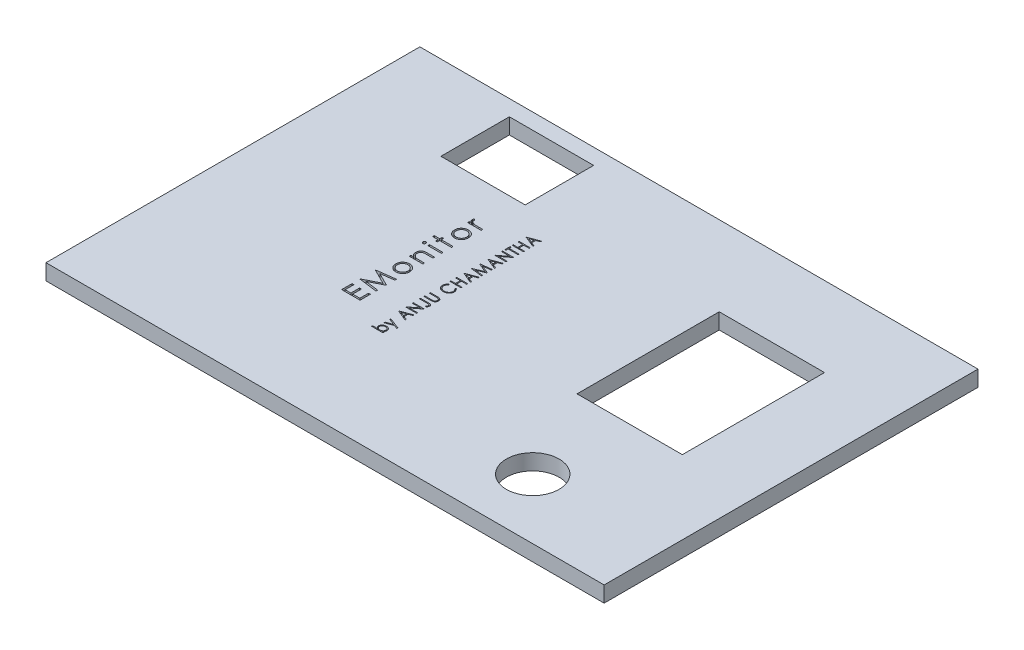
from build123d import *

# Parameters (mm, degrees)
SKETCH1_W           = 106
SKETCH1_H           = 71
SKETCH1_R           = 5
SKETCH1_W_2         = 20
SKETCH1_H_2         = 27
BOSS_EXTRUDE3_DEPTH = 3
SKETCH2_W           = 16
SKETCH2_H           = 13
CUT_EXTRUDE1_DEPTH  = 103.258706534
SKETCH3_W           = 2.557692308
SKETCH3_H           = 0.314102564
CUT_EXTRUDE2_DEPTH  = 1


with BuildPart() as part:
    # Sketch1 → Boss-Extrude3 (new body)
    with BuildSketch(Plane(origin=(0, 0, 0), x_dir=(1, 0, 0), z_dir=(0, 1, 0))):
        with Locations((-42.793088024, 0.158482143)):
            Rectangle(SKETCH1_W, SKETCH1_H)
        with Locations(Location((-14.793088024, -23.904605951, 0), (0, 0, 270))):
            Circle(SKETCH1_R, mode=Mode.SUBTRACT)
        with Locations((-13.793088024, 7.010525239)):
            Rectangle(SKETCH1_W_2, SKETCH1_H_2, mode=Mode.SUBTRACT)
    extrude(amount=BOSS_EXTRUDE3_DEPTH)

    # Sketch2 → Cut-Extrude1 (cut, through all)
    with BuildSketch(Plane(origin=(0, 3, 0), x_dir=(1, 0, 0), z_dir=(0, 1, 0))):
        with Locations((-67.793088024, 26.158482143)):
            Rectangle(SKETCH2_W, SKETCH2_H)
    extrude(amount=-CUT_EXTRUDE1_DEPTH, mode=Mode.SUBTRACT)

    # Sketch3 → Cut-Extrude2 (cut)
    # profile 1 of 24: a face of its own
    with BuildSketch(Plane(origin=(0, 3, 0), x_dir=(1, 0, 0), z_dir=(0, 1, 0))):
        Polygon((-63.293088024, -11.696646062), (-63.293088024, -9.722287088), (-62.934113665, -9.722287088), (-62.934113665, -11.382543498), (-61.857190588, -11.382543498), (-61.857190588, -9.722287088), (-61.498216229, -9.722287088), (-61.498216229, -11.382543498), (-60.152062383, -11.382543498), (-60.152062383, -9.722287088), (-59.793088024, -9.722287088), (-59.793088024, -11.696646062), align=None)
    # profile 2 of 24: a face of its own
    with BuildSketch(Plane(origin=(0, 3, 0), x_dir=(1, 0, 0), z_dir=(0, 1, 0))):
        Polygon((-59.793088024, -8.681261447), (-63.293088024, -8.219222184), (-63.293088024, -8.174350389), (-60.421293153, -6.72933837), (-63.293088024, -5.28783196), (-63.293088024, -5.242259043), (-59.793088024, -4.777415293), (-59.793088024, -5.092920101), (-62.311517511, -5.428056319), (-59.793088024, -6.691477793), (-59.793088024, -6.762291094), (-62.317126486, -8.030620421), (-59.793088024, -8.365055517), align=None)
    # profile 3 of 24: a face of its own
    with BuildSketch(Plane(origin=(0, 3, 0), x_dir=(1, 0, 0), z_dir=(0, 1, 0))):
        with BuildLine():
            add(Edge.make_bspline(
                [(-62.395652127, -2.32152587), (-62.394630236, -2.273534597), (-62.392626557, -2.17943544), (-62.371211591, -2.041627554), (-62.338464227, -1.910082418), (-62.293192665, -1.784296226), (-62.232510714, -1.66587993), (-62.160101423, -1.553108686), (-62.07431883, -1.446291677), (-62.007960761, -1.382268648), (-61.974277928, -1.349771062)],
                knots=[0, 0, 0, 0, 1.054011418, 2.066658804, 3.057071809, 4.030435133, 4.997543892, 5.974964718, 6.972108034, 8, 8, 8, 8], degree=3))
            add(Edge.make_bspline(
                [(-61.974277928, -1.349771062), (-61.942063942, -1.321789108), (-61.8782594, -1.266366728), (-61.774803787, -1.195301009), (-61.667663687, -1.134079449), (-61.55541636, -1.085016488), (-61.439041689, -1.046331464), (-61.318139678, -1.018865768), (-61.19297733, -1.002528833), (-61.107973492, -1.000325866), (-61.06492296, -0.999210165)],
                knots=[0, 0, 0, 0, 1.025258237, 2.030674902, 3.01204498, 3.988269485, 4.97094183, 5.956517959, 6.965070386, 8, 8, 8, 8], degree=3))
            add(Edge.make_bspline(
                [(-61.06492296, -0.999210165), (-61.021622903, -1.000191502), (-60.936059969, -1.00213067), (-60.810040603, -1.020474287), (-60.687845781, -1.049005373), (-60.569987087, -1.089837211), (-60.45610426, -1.14219532), (-60.34669471, -1.206086008), (-60.241542577, -1.281957625), (-60.141540739, -1.367961622), (-60.049374524, -1.463013498), (-59.969046254, -1.566129646), (-59.90022473, -1.67528368), (-59.844788314, -1.791927033), (-59.801078614, -1.91499452), (-59.770378598, -2.044751588), (-59.751816914, -2.180996658), (-59.749433341, -2.27402388), (-59.748216229, -2.32152587)],
                knots=[0, 0, 0, 0, 0.998656419, 1.973391657, 2.932242238, 3.890759089, 4.846373663, 5.82037756, 6.809684879, 7.83454468, 8.860553229, 9.859544525, 10.845671541, 11.83227036, 12.833544569, 13.85385346, 14.904124723, 16, 16, 16, 16], degree=3))
            add(Edge.make_bspline(
                [(-59.748216229, -2.32152587), (-59.749437426, -2.369260589), (-59.7518292, -2.462751449), (-59.770306483, -2.599477431), (-59.801064465, -2.72946705), (-59.844931958, -2.852695649), (-59.900226502, -2.969840496), (-59.968838192, -3.079626992), (-60.049398347, -3.182826908), (-60.141534284, -3.277898892), (-60.24154424, -3.363897498), (-60.346694279, -3.439770506), (-60.456104372, -3.503660832), (-60.569987057, -3.556019036), (-60.687845789, -3.596850849), (-60.810040601, -3.625381942), (-60.93605997, -3.643725556), (-61.021622903, -3.645664725), (-61.06492296, -3.646646062)],
                knots=[0, 0, 0, 0, 1.099876186, 2.154163076, 3.173186993, 4.173200201, 5.163417411, 6.152872554, 7.150605724, 8.17532212, 9.198891216, 10.186952605, 11.159729845, 12.11414092, 13.071450619, 14.029093627, 15.002601286, 16, 16, 16, 16], degree=3))
            add(Edge.make_bspline(
                [(-61.06492296, -3.646646062), (-61.107740461, -3.645525421), (-61.192511755, -3.643306743), (-61.317424955, -3.626947513), (-61.437956936, -3.599780665), (-61.553696108, -3.560559356), (-61.66567365, -3.511587471), (-61.773206585, -3.450982079), (-61.87621014, -3.379228919), (-61.93993007, -3.324021853), (-61.972174563, -3.296085165)],
                knots=[0, 0, 0, 0, 1.031377469, 2.041950136, 3.029500481, 4.003457997, 4.981637986, 5.969878303, 6.97268806, 8, 8, 8, 8], degree=3))
            add(Edge.make_bspline(
                [(-61.972174563, -3.296085165), (-62.006149502, -3.263636574), (-62.072967198, -3.19982071), (-62.158499722, -3.092471982), (-62.232415796, -2.979978161), (-62.291892012, -2.860253235), (-62.338730529, -2.734570377), (-62.371296044, -2.602351134), (-62.392549399, -2.464075619), (-62.394607577, -2.369515998), (-62.395652127, -2.32152587)],
                knots=[0, 0, 0, 0, 1.027980169, 2.021703884, 2.998553061, 3.971491411, 4.943284454, 5.930300938, 6.949603206, 8, 8, 8, 8], degree=3))
        make_face()
        with BuildLine():
            add(Edge.make_bspline(
                [(-62.081549563, -2.322928114), (-62.080584971, -2.356865725), (-62.078680689, -2.423864854), (-62.064196783, -2.522484437), (-62.041249281, -2.617424595), (-62.008645219, -2.708865425), (-61.966546344, -2.796498651), (-61.914837892, -2.880407852), (-61.854205287, -2.960841067), (-61.784741255, -3.036220129), (-61.708867311, -3.105413582), (-61.628000708, -3.165851319), (-61.543380156, -3.217532093), (-61.454878314, -3.259803899), (-61.362193426, -3.292223372), (-61.265871314, -3.315196426), (-61.16562112, -3.329706852), (-61.097458009, -3.331587706), (-61.062819595, -3.332543498)],
                knots=[0, 0, 0, 0, 1.02155314, 2.01673505, 2.994700672, 3.958461264, 4.934171024, 5.916582427, 6.921469794, 7.962398674, 8.998583302, 10.009097305, 10.997513862, 11.97957236, 12.956600784, 13.948243505, 14.957359924, 16, 16, 16, 16], degree=3))
            add(Edge.make_bspline(
                [(-61.062819595, -3.332543498), (-61.018067568, -3.330936675), (-60.929243162, -3.32774743), (-60.79843204, -3.301812194), (-60.672850187, -3.258425914), (-60.553233801, -3.199838634), (-60.442561523, -3.126432415), (-60.343890039, -3.039945349), (-60.258704228, -2.941305648), (-60.188023382, -2.831689148), (-60.131863626, -2.71333483), (-60.092064651, -2.588078509), (-60.066192958, -2.457437815), (-60.063621484, -2.368157084), (-60.062318794, -2.322928114)],
                knots=[0, 0, 0, 0, 1.016792936, 2.018143844, 3.017858371, 4.030088057, 5.03801393, 6.028138512, 7.003788237, 7.991172063, 8.984598303, 9.972568034, 10.972917682, 12, 12, 12, 12], degree=3))
            add(Edge.make_bspline(
                [(-60.062318794, -2.322928114), (-60.063629074, -2.277701745), (-60.066215531, -2.188426149), (-60.09193435, -2.057966972), (-60.132038011, -1.933053), (-60.187960221, -1.814821612), (-60.258972636, -1.705255009), (-60.343409013, -1.605905888), (-60.442822864, -1.520157277), (-60.553380393, -1.446823672), (-60.672664745, -1.387276929), (-60.798455217, -1.344093727), (-60.929237259, -1.318096141), (-61.01806559, -1.314915313), (-61.062819595, -1.313312729)],
                knots=[0, 0, 0, 0, 1.02726834, 2.027799167, 3.010890988, 4.004497153, 4.992059811, 5.971914811, 6.958719428, 7.966827853, 8.981595046, 9.981490638, 10.983022906, 12, 12, 12, 12], degree=3))
            add(Edge.make_bspline(
                [(-61.062819595, -1.313312729), (-61.097458216, -1.314268192), (-61.165621734, -1.316148397), (-61.265868967, -1.330663542), (-61.362202012, -1.35361917), (-61.454846696, -1.386102725), (-61.543609774, -1.428186761), (-61.62775266, -1.480861039), (-61.709147373, -1.541051923), (-61.784495973, -1.611080182), (-61.854232364, -1.686380567), (-61.914861404, -1.766846377), (-61.96631909, -1.850631156), (-62.009005307, -1.938009791), (-62.040952654, -2.029462345), (-62.064329283, -2.124269478), (-62.078619481, -2.222468286), (-62.080566622, -2.28922733), (-62.081549563, -2.322928114)],
                knots=[0, 0, 0, 0, 1.042975879, 2.052417305, 3.044379404, 4.0217225, 5.00409729, 5.996508862, 7.007348322, 8.048612455, 9.089876587, 10.095087598, 11.077815406, 12.047498138, 13.018202342, 13.98964644, 14.985148868, 16, 16, 16, 16], degree=3))
        make_face(mode=Mode.SUBTRACT)
    # profile 4 of 24: a face of its own
    with BuildSketch(Plane(origin=(0, 3, 0), x_dir=(1, 0, 0), z_dir=(0, 1, 0))):
        with BuildLine():
            Line((-62.350780332, 0.221302656), (-62.350780332, 0.53540522))
            Line((-62.350780332, 0.53540522), (-61.889442191, 0.53540522))
            add(Edge.make_bspline(
                [(-61.889442191, 0.53540522), (-61.931347479, 0.568884961), (-62.012538428, 0.633751524), (-62.118410621, 0.742888161), (-62.207254326, 0.856685202), (-62.27720597, 0.976990891), (-62.330110573, 1.102567258), (-62.368261025, 1.23305798), (-62.391150011, 1.369169342), (-62.394139674, 1.461734235), (-62.395652127, 1.508562271)],
                knots=[0, 0, 0, 0, 1.127869841, 2.185233117, 3.191641716, 4.159226741, 5.10472073, 6.052603964, 7.014823782, 8, 8, 8, 8], degree=3))
            add(Edge.make_bspline(
                [(-62.395652127, 1.508562271), (-62.394008133, 1.555916782), (-62.390788827, 1.648647441), (-62.362340642, 1.783155064), (-62.317583827, 1.909549781), (-62.254034045, 2.025968555), (-62.175552366, 2.131162522), (-62.083982556, 2.223217823), (-61.979208273, 2.2999793), (-61.8814368, 2.351287485), (-61.794552757, 2.38444322), (-61.720244329, 2.406236723), (-61.637420386, 2.423866716), (-61.546287814, 2.439664345), (-61.446479935, 2.450202982), (-61.338235158, 2.458556849), (-61.221572167, 2.464532129), (-61.140885663, 2.464769826), (-61.099277928, 2.464892399)],
                knots=[0, 0, 0, 0, 1.235846195, 2.420061613, 3.574938557, 4.72781258, 5.870749808, 6.993217613, 8.10690044, 9.251157787, 9.865716151, 10.534141144, 11.271861846, 12.076851687, 12.949307443, 13.892392281, 14.913166647, 16, 16, 16, 16], degree=3))
            Line((-61.099277928, 2.464892399), (-59.793088024, 2.464892399))
            Line((-59.793088024, 2.464892399), (-59.793088024, 2.150789835))
            Line((-59.793088024, 2.150789835), (-60.996213024, 2.150789835))
            add(Edge.make_bspline(
                [(-60.996213024, 2.150789835), (-61.031035519, 2.150597427), (-61.097645026, 2.150229382), (-61.1930134, 2.149053359), (-61.279268849, 2.146285057), (-61.356659264, 2.142235149), (-61.42490139, 2.1365663), (-61.484340655, 2.130497695), (-61.534450561, 2.123137371), (-61.564615605, 2.116573959), (-61.578144114, 2.11363038)],
                knots=[0, 0, 0, 0, 1.430803381, 2.736883362, 3.918614142, 4.976458302, 5.92063272, 6.731858525, 7.431260095, 8, 8, 8, 8], degree=3))
            add(Edge.make_bspline(
                [(-61.578144114, 2.11363038), (-61.617883828, 2.103057592), (-61.694167064, 2.082762365), (-61.797462414, 2.031592349), (-61.886118722, 1.96847468), (-61.958312655, 1.890273337), (-62.014513775, 1.799088613), (-62.053479162, 1.694768922), (-62.077857916, 1.57839392), (-62.080284687, 1.496539008), (-62.081549563, 1.453874771)],
                knots=[0, 0, 0, 0, 1.084232, 2.08126119, 3.027460722, 3.945137793, 4.874029258, 5.839697328, 6.874011781, 8, 8, 8, 8], degree=3))
            add(Edge.make_bspline(
                [(-62.081549563, 1.453874771), (-62.081080405, 1.428604842), (-62.080151955, 1.378596304), (-62.070600815, 1.304479079), (-62.055502076, 1.232364863), (-62.033250782, 1.162417829), (-62.005939292, 1.094410965), (-61.973082626, 1.027866942), (-61.932635095, 0.964321403), (-61.887416776, 0.902728673), (-61.837345014, 0.845412998), (-61.784498577, 0.792085402), (-61.728223477, 0.744547187), (-61.669423397, 0.701478563), (-61.607291594, 0.664300286), (-61.542427278, 0.631847202), (-61.474745132, 0.604311506), (-61.42777007, 0.590628814), (-61.404265909, 0.583782624)],
                knots=[0, 0, 0, 0, 1.023827899, 2.026128959, 3.023898047, 4.006668367, 4.997079741, 5.992687789, 7.009920206, 8.046337072, 9.087246971, 10.092051999, 11.086713115, 12.070168086, 13.043348831, 14.017773728, 15.008185103, 16, 16, 16, 16], degree=3))
            add(Edge.make_bspline(
                [(-61.404265909, 0.583782624), (-61.387010706, 0.579842975), (-61.349447031, 0.571266566), (-61.287802612, 0.562003386), (-61.216492637, 0.553595811), (-61.13560032, 0.546558852), (-61.044842445, 0.542253436), (-60.944606607, 0.537559039), (-60.834493119, 0.535849978), (-60.757831426, 0.535557624), (-60.717867672, 0.53540522)],
                knots=[0, 0, 0, 0, 0.615963638, 1.340920617, 2.168419149, 3.115676021, 4.16674242, 5.331190069, 6.6087489, 8, 8, 8, 8], degree=3))
            Line((-60.717867672, 0.53540522), (-59.793088024, 0.53540522))
            Line((-59.793088024, 0.53540522), (-59.793088024, 0.221302656))
            Line((-59.793088024, 0.221302656), (-62.350780332, 0.221302656))
        make_face()
    # profile 5 of 24: a face of its own
    with BuildSketch(Plane(origin=(0, 3, 0), x_dir=(1, 0, 0), z_dir=(0, 1, 0))):
        with BuildLine():
            add(Edge.make_bspline(
                [(-63.427703409, 3.885926053), (-63.426799257, 3.905417369), (-63.425028752, 3.943585109), (-63.409867275, 3.998778376), (-63.38416759, 4.049035388), (-63.349687909, 4.093613121), (-63.309138466, 4.131865008), (-63.261877497, 4.158645718), (-63.210818859, 4.175858115), (-63.175203769, 4.17793667), (-63.157070396, 4.178994963)],
                knots=[0, 0, 0, 0, 1.055194115, 2.066272739, 3.074728998, 4.095836921, 5.109056067, 6.073838105, 7.019297344, 8, 8, 8, 8], degree=3))
            add(Edge.make_bspline(
                [(-63.157070396, 4.178994963), (-63.139407743, 4.177912804), (-63.104490768, 4.175773502), (-63.054317296, 4.158659013), (-63.007713012, 4.131636776), (-62.967242302, 4.09363765), (-62.932781682, 4.049028889), (-62.907076943, 3.998780103), (-62.891916806, 3.943584655), (-62.890146117, 3.905417215), (-62.88924187, 3.885926053)],
                knots=[0, 0, 0, 0, 0.96129708, 1.900370562, 2.859976407, 3.87933698, 4.906634145, 5.921202961, 6.938410037, 8, 8, 8, 8], degree=3))
            add(Edge.make_bspline(
                [(-62.88924187, 3.885926053), (-62.890111591, 3.866657778), (-62.891804387, 3.829154598), (-62.907374405, 3.774787755), (-62.932790478, 3.724959266), (-62.967016663, 3.680294593), (-63.007961561, 3.6430644), (-63.054288854, 3.615966075), (-63.104498009, 3.598891113), (-63.139410175, 3.596746484), (-63.157070396, 3.59566163)],
                knots=[0, 0, 0, 0, 1.054934014, 2.053291228, 3.073705704, 4.106921865, 5.123545215, 6.088680038, 7.033164197, 8, 8, 8, 8], degree=3))
            add(Edge.make_bspline(
                [(-63.157070396, 3.59566163), (-63.175201246, 3.596722717), (-63.210811378, 3.598806758), (-63.261906411, 3.615978874), (-63.308887913, 3.642838682), (-63.349913412, 3.680319245), (-63.384158847, 3.724952705), (-63.409569829, 3.774789451), (-63.425141168, 3.82915415), (-63.426833782, 3.866657626), (-63.427703409, 3.885926053)],
                knots=[0, 0, 0, 0, 0.98631895, 1.937192651, 2.907499808, 3.917963147, 4.944918757, 5.95915025, 6.951458133, 8, 8, 8, 8], degree=3))
        make_face()
    # profile 6 of 24: a face of its own
    with BuildSketch(Plane(origin=(0, 3, 0), x_dir=(1, 0, 0), z_dir=(0, 1, 0))):
        with Locations((-61.071934178, 3.887328297)):
            Rectangle(SKETCH3_W, SKETCH3_H)
    # profile 7 of 24: a face of its own
    with BuildSketch(Plane(origin=(0, 3, 0), x_dir=(1, 0, 0), z_dir=(0, 1, 0))):
        Polygon((-63.382831614, 5.668738553), (-63.382831614, 5.982841117), (-62.350780332, 5.982841117), (-62.350780332, 6.431559066), (-62.036677768, 6.431559066), (-62.036677768, 5.982841117), (-59.793088024, 5.982841117), (-59.793088024, 5.668738553), (-62.036677768, 5.668738553), (-62.036677768, 5.220020604), (-62.350780332, 5.220020604), (-62.350780332, 5.668738553), align=None)
    # profile 8 of 24: a face of its own
    with BuildSketch(Plane(origin=(0, 3, 0), x_dir=(1, 0, 0), z_dir=(0, 1, 0))):
        with BuildLine():
            add(Edge.make_bspline(
                [(-62.395652127, 8.842576694), (-62.394630236, 8.890567967), (-62.392626557, 8.984667125), (-62.371211591, 9.12247501), (-62.338464227, 9.254020146), (-62.293192665, 9.379806339), (-62.232510714, 9.498222634), (-62.160101423, 9.610993878), (-62.07431883, 9.717810887), (-62.007960761, 9.781833916), (-61.974277928, 9.814331502)],
                knots=[0, 0, 0, 0, 1.054011418, 2.066658804, 3.057071809, 4.030435133, 4.997543892, 5.974964718, 6.972108034, 8, 8, 8, 8], degree=3))
            add(Edge.make_bspline(
                [(-61.974277928, 9.814331502), (-61.942063942, 9.842313456), (-61.8782594, 9.897735836), (-61.774803787, 9.968801555), (-61.667663687, 10.030023115), (-61.55541636, 10.079086076), (-61.439041689, 10.1177711), (-61.318139678, 10.145236796), (-61.19297733, 10.161573731), (-61.107973492, 10.163776698), (-61.06492296, 10.164892399)],
                knots=[0, 0, 0, 0, 1.025258237, 2.030674902, 3.01204498, 3.988269485, 4.97094183, 5.956517959, 6.965070386, 8, 8, 8, 8], degree=3))
            add(Edge.make_bspline(
                [(-61.06492296, 10.164892399), (-61.021622903, 10.163911062), (-60.936059969, 10.161971894), (-60.810040603, 10.143628277), (-60.687845781, 10.115097191), (-60.569987087, 10.074265353), (-60.45610426, 10.021907244), (-60.34669471, 9.958016556), (-60.241542577, 9.882144939), (-60.141540739, 9.796140942), (-60.049374524, 9.701089066), (-59.969046254, 9.597972918), (-59.90022473, 9.488818884), (-59.844788314, 9.372175531), (-59.801078614, 9.249108044), (-59.770378598, 9.119350976), (-59.751816914, 8.983105906), (-59.749433341, 8.890078684), (-59.748216229, 8.842576694)],
                knots=[0, 0, 0, 0, 0.998656419, 1.973391657, 2.932242238, 3.890759089, 4.846373663, 5.82037756, 6.809684879, 7.83454468, 8.860553229, 9.859544525, 10.845671541, 11.83227036, 12.833544569, 13.85385346, 14.904124723, 16, 16, 16, 16], degree=3))
            add(Edge.make_bspline(
                [(-59.748216229, 8.842576694), (-59.749437426, 8.794841975), (-59.7518292, 8.701351115), (-59.770306483, 8.564625133), (-59.801064465, 8.434635514), (-59.844931958, 8.311406916), (-59.900226502, 8.194262069), (-59.968838192, 8.084475572), (-60.049398347, 7.981275656), (-60.141534284, 7.886203672), (-60.24154424, 7.800205066), (-60.346694279, 7.724332058), (-60.456104372, 7.660441732), (-60.569987057, 7.608083528), (-60.687845789, 7.567251715), (-60.810040601, 7.538720622), (-60.93605997, 7.520377008), (-61.021622903, 7.518437839), (-61.06492296, 7.517456502)],
                knots=[0, 0, 0, 0, 1.099876186, 2.154163076, 3.173186993, 4.173200201, 5.163417411, 6.152872554, 7.150605724, 8.17532212, 9.198891216, 10.186952605, 11.159729845, 12.11414092, 13.071450619, 14.029093627, 15.002601286, 16, 16, 16, 16], degree=3))
            add(Edge.make_bspline(
                [(-61.06492296, 7.517456502), (-61.107740461, 7.518577143), (-61.192511755, 7.520795821), (-61.317424955, 7.537155051), (-61.437956936, 7.564321899), (-61.553696108, 7.603543208), (-61.66567365, 7.652515093), (-61.773206585, 7.713120485), (-61.87621014, 7.784873645), (-61.93993007, 7.840080711), (-61.972174563, 7.868017399)],
                knots=[0, 0, 0, 0, 1.031377469, 2.041950136, 3.029500481, 4.003457997, 4.981637986, 5.969878303, 6.97268806, 8, 8, 8, 8], degree=3))
            add(Edge.make_bspline(
                [(-61.972174563, 7.868017399), (-62.006149502, 7.90046599), (-62.072967198, 7.964281854), (-62.158499722, 8.071630582), (-62.232415796, 8.184124403), (-62.291892012, 8.303849329), (-62.338730529, 8.429532187), (-62.371296044, 8.56175143), (-62.392549399, 8.700026945), (-62.394607577, 8.794586566), (-62.395652127, 8.842576694)],
                knots=[0, 0, 0, 0, 1.027980169, 2.021703884, 2.998553061, 3.971491411, 4.943284454, 5.930300938, 6.949603206, 8, 8, 8, 8], degree=3))
        make_face()
        with BuildLine():
            add(Edge.make_bspline(
                [(-62.081549563, 8.841174451), (-62.080584971, 8.807236839), (-62.078680689, 8.74023771), (-62.064196783, 8.641618127), (-62.041249281, 8.546677969), (-62.008645219, 8.455237139), (-61.966546344, 8.367603914), (-61.914837892, 8.283694712), (-61.854205287, 8.203261497), (-61.784741255, 8.127882435), (-61.708867311, 8.058688982), (-61.628000708, 7.998251245), (-61.543380156, 7.946570471), (-61.454878314, 7.904298665), (-61.362193426, 7.871879192), (-61.265871314, 7.848906138), (-61.16562112, 7.834395712), (-61.097458009, 7.832514858), (-61.062819595, 7.831559066)],
                knots=[0, 0, 0, 0, 1.02155314, 2.01673505, 2.994700672, 3.958461264, 4.934171024, 5.916582427, 6.921469794, 7.962398674, 8.998583302, 10.009097305, 10.997513862, 11.97957236, 12.956600784, 13.948243505, 14.957359924, 16, 16, 16, 16], degree=3))
            add(Edge.make_bspline(
                [(-61.062819595, 7.831559066), (-61.018067568, 7.83316589), (-60.929243162, 7.836355134), (-60.79843204, 7.86229037), (-60.672850187, 7.90567665), (-60.553233801, 7.96426393), (-60.442561523, 8.037670149), (-60.343890039, 8.124157215), (-60.258704228, 8.222796916), (-60.188023382, 8.332413416), (-60.131863626, 8.450767734), (-60.092064651, 8.576024055), (-60.066192958, 8.706664749), (-60.063621484, 8.79594548), (-60.062318794, 8.841174451)],
                knots=[0, 0, 0, 0, 1.016792936, 2.018143844, 3.017858371, 4.030088057, 5.03801393, 6.028138512, 7.003788237, 7.991172063, 8.984598303, 9.972568034, 10.972917682, 12, 12, 12, 12], degree=3))
            add(Edge.make_bspline(
                [(-60.062318794, 8.841174451), (-60.063629074, 8.886400819), (-60.066215531, 8.975676415), (-60.09193435, 9.106135592), (-60.132038011, 9.231049564), (-60.187960221, 9.349280952), (-60.258972636, 9.458847555), (-60.343409013, 9.558196676), (-60.442822864, 9.643945288), (-60.553380393, 9.717278892), (-60.672664745, 9.776825635), (-60.798455217, 9.820008837), (-60.929237259, 9.846006423), (-61.01806559, 9.849187252), (-61.062819595, 9.850789835)],
                knots=[0, 0, 0, 0, 1.02726834, 2.027799167, 3.010890988, 4.004497153, 4.992059811, 5.971914811, 6.958719428, 7.966827853, 8.981595046, 9.981490638, 10.983022906, 12, 12, 12, 12], degree=3))
            add(Edge.make_bspline(
                [(-61.062819595, 9.850789835), (-61.097458216, 9.849834372), (-61.165621734, 9.847954168), (-61.265868967, 9.833439022), (-61.362202012, 9.810483394), (-61.454846696, 9.777999839), (-61.543609774, 9.735915803), (-61.62775266, 9.683241525), (-61.709147373, 9.623050642), (-61.784495973, 9.553022382), (-61.854232364, 9.477721997), (-61.914861404, 9.397256187), (-61.96631909, 9.313471408), (-62.009005307, 9.226092773), (-62.040952654, 9.134640219), (-62.064329283, 9.039833087), (-62.078619481, 8.941634278), (-62.080566622, 8.874875234), (-62.081549563, 8.841174451)],
                knots=[0, 0, 0, 0, 1.042975879, 2.052417305, 3.044379404, 4.0217225, 5.00409729, 5.996508862, 7.007348322, 8.048612455, 9.089876587, 10.095087598, 11.077815406, 12.047498138, 13.018202342, 13.98964644, 14.985148868, 16, 16, 16, 16], degree=3))
        make_face(mode=Mode.SUBTRACT)
    # profile 9 of 24: a face of its own
    with BuildSketch(Plane(origin=(0, 3, 0), x_dir=(1, 0, 0), z_dir=(0, 1, 0))):
        with BuildLine():
            Line((-62.350780332, 11.29566163), (-62.350780332, 11.609764194))
            Line((-62.350780332, 11.609764194), (-61.974277928, 11.609764194))
            add(Edge.make_bspline(
                [(-61.974277928, 11.609764194), (-62.00934945, 11.632938116), (-62.076423463, 11.677258061), (-62.165014082, 11.751267878), (-62.239201236, 11.826267453), (-62.297570165, 11.904226134), (-62.341682822, 11.984379599), (-62.372679405, 12.066051956), (-62.391901328, 12.149442923), (-62.394400186, 12.205618385), (-62.395652127, 12.233762592)],
                knots=[0, 0, 0, 0, 1.280091057, 2.448164201, 3.510831157, 4.48793739, 5.405868014, 6.289422536, 7.142991551, 8, 8, 8, 8], degree=3))
            add(Edge.make_bspline(
                [(-62.395652127, 12.233762592), (-62.3944616, 12.255588918), (-62.392012014, 12.300498003), (-62.37480119, 12.368480593), (-62.347323167, 12.438524045), (-62.321482945, 12.483666432), (-62.308011903, 12.507200092)],
                knots=[0, 0, 0, 0, 0.901110191, 1.854092781, 2.881294221, 4, 4, 4, 4], degree=3))
            Line((-62.308011903, 12.507200092), (-62.035976646, 12.33472413))
            add(Edge.make_bspline(
                [(-62.035976646, 12.33472413), (-62.042716912, 12.319615109), (-62.055511228, 12.290935294), (-62.070653238, 12.248980728), (-62.079569154, 12.210299391), (-62.080919871, 12.185655833), (-62.081549563, 12.174167239)],
                knots=[0, 0, 0, 0, 1.180555205, 2.24091978, 3.179933427, 4, 4, 4, 4], degree=3))
            add(Edge.make_bspline(
                [(-62.081549563, 12.174167239), (-62.079882682, 12.148953938), (-62.076482729, 12.097526112), (-62.049372064, 12.022274778), (-62.006829245, 11.948599403), (-61.958385553, 11.890651169), (-61.911851149, 11.845624305), (-61.871123285, 11.813242127), (-61.825032481, 11.78417864), (-61.775360248, 11.755986285), (-61.720859957, 11.72979346), (-61.661442695, 11.706386322), (-61.597599109, 11.684496143), (-61.553207175, 11.672168602), (-61.530467832, 11.665853938)],
                knots=[0, 0, 0, 0, 1.125322384, 2.295331465, 3.535939348, 4.916963136, 5.656144286, 6.429838446, 7.238666481, 8.090384391, 8.983239461, 9.940052224, 10.944811494, 12, 12, 12, 12], degree=3))
            add(Edge.make_bspline(
                [(-61.530467832, 11.665853938), (-61.510191781, 11.661113366), (-61.465056658, 11.650560704), (-61.389679258, 11.640574312), (-61.300680631, 11.630309928), (-61.197957387, 11.623300387), (-61.081114655, 11.616678942), (-60.950656496, 11.613020982), (-60.806224343, 11.609880578), (-60.705483482, 11.609804226), (-60.652663345, 11.609764194)],
                knots=[0, 0, 0, 0, 0.566841273, 1.261806378, 2.068780918, 3.007109044, 4.065315289, 5.256255371, 6.561408263, 8, 8, 8, 8], degree=3))
            Line((-60.652663345, 11.609764194), (-59.793088024, 11.609764194))
            Line((-59.793088024, 11.609764194), (-59.793088024, 11.29566163))
            Line((-59.793088024, 11.29566163), (-62.350780332, 11.29566163))
        make_face()
    # profile 10 of 24: a face of its own
    with BuildSketch(Plane(origin=(0, 3, 0), x_dir=(1, 0, 0), z_dir=(0, 1, 0))):
        Polygon((-54.373219341, 14.47040522), (-52.256552674, 15.257371032), (-52.256552674, 15.05130132), (-52.934971477, 14.799438339), (-52.934971477, 14.062505914), (-52.256552674, 13.784354205), (-52.256552674, 13.574892399), (-54.373219341, 14.443268468), align=None)
        Polygon((-53.876701579, 14.449204632), (-53.152065494, 14.151972394), (-53.152065494, 14.718452095), align=None, mode=Mode.SUBTRACT)
    # profile 11 of 24: a face of its own
    with BuildSketch(Plane(origin=(0, 3, 0), x_dir=(1, 0, 0), z_dir=(0, 1, 0))):
        Polygon((-54.373219341, 11.789294109), (-54.373219341, 11.979251374), (-53.504843272, 11.979251374), (-53.504843272, 12.901900946), (-54.373219341, 12.901900946), (-54.373219341, 13.091858211), (-52.256552674, 13.091858211), (-52.256552674, 12.901900946), (-53.287749255, 12.901900946), (-53.287749255, 11.979251374), (-52.256552674, 11.979251374), (-52.256552674, 11.789294109), align=None)
    # profile 12 of 24: a face of its own
    with BuildSketch(Plane(origin=(0, 3, 0), x_dir=(1, 0, 0), z_dir=(0, 1, 0))):
        Polygon((-54.156125323, 10.383610348), (-54.373219341, 10.383610348), (-54.373219341, 11.387670177), (-54.156125323, 11.387670177), (-54.156125323, 10.980618895), (-52.256552674, 10.980618895), (-52.256552674, 10.79066163), (-54.156125323, 10.79066163), align=None)
    # profile 13 of 24: a face of its own
    with BuildSketch(Plane(origin=(0, 3, 0), x_dir=(1, 0, 0), z_dir=(0, 1, 0))):
        Polygon((-52.256552674, 8.489465049), (-54.373219341, 8.489465049), (-54.373219341, 8.529322154), (-52.787839399, 9.737755647), (-54.373219341, 9.737755647), (-54.373219341, 9.927712912), (-52.256552674, 9.927712912), (-52.256552674, 9.884463713), (-53.837268486, 8.679422314), (-52.256552674, 8.679422314), align=None)
    # profile 14 of 24: a face of its own
    with BuildSketch(Plane(origin=(0, 3, 0), x_dir=(1, 0, 0), z_dir=(0, 1, 0))):
        Polygon((-54.373219341, 7.192328297), (-52.256552674, 7.979294109), (-52.256552674, 7.773224397), (-52.934971477, 7.521361416), (-52.934971477, 6.784428991), (-52.256552674, 6.506277282), (-52.256552674, 6.296815476), (-54.373219341, 7.165191545), align=None)
        Polygon((-53.876701579, 7.171127709), (-53.152065494, 6.873895471), (-53.152065494, 7.440375172), align=None, mode=Mode.SUBTRACT)
    # profile 15 of 24: a face of its own
    with BuildSketch(Plane(origin=(0, 3, 0), x_dir=(1, 0, 0), z_dir=(0, 1, 0))):
        Polygon((-52.256552674, 3.832798382), (-54.373219341, 4.076181128), (-54.373219341, 4.153351267), (-52.636467204, 4.877563339), (-54.373219341, 5.59880733), (-54.373219341, 5.678521539), (-52.256552674, 5.922328297), (-52.256552674, 5.731098996), (-53.776210794, 5.555982143), (-52.256552674, 4.925052656), (-52.256552674, 4.832618094), (-53.776210794, 4.199144536), (-52.256552674, 4.024451694), align=None)
    # profile 16 of 24: a face of its own
    with BuildSketch(Plane(origin=(0, 3, 0), x_dir=(1, 0, 0), z_dir=(0, 1, 0))):
        Polygon((-54.373219341, 2.617071886), (-52.256552674, 3.404037698), (-52.256552674, 3.197967987), (-52.934971477, 2.946105006), (-52.934971477, 2.209172581), (-52.256552674, 1.931020871), (-52.256552674, 1.721559066), (-54.373219341, 2.589935134), align=None)
        Polygon((-53.876701579, 2.595871299), (-53.152065494, 2.298639061), (-53.152065494, 2.865118761), align=None, mode=Mode.SUBTRACT)
    # profile 17 of 24: a face of its own
    with BuildSketch(Plane(origin=(0, 3, 0), x_dir=(1, 0, 0), z_dir=(0, 1, 0))):
        Polygon((-54.373219341, -0.064039225), (-54.373219341, 0.12591804), (-53.504843272, 0.12591804), (-53.504843272, 1.048567613), (-54.373219341, 1.048567613), (-54.373219341, 1.238524878), (-52.256552674, 1.238524878), (-52.256552674, 1.048567613), (-53.287749255, 1.048567613), (-53.287749255, 0.12591804), (-52.256552674, 0.12591804), (-52.256552674, -0.064039225), align=None)
    # profile 18 of 24: a face of its own
    with BuildSketch(Plane(origin=(0, 3, 0), x_dir=(1, 0, 0), z_dir=(0, 1, 0))):
        with BuildLine():
            Line((-53.984824576, -0.601346917), (-53.85762105, -0.747630971))
            add(Edge.make_bspline(
                [(-53.85762105, -0.747630971), (-53.885255268, -0.767938461), (-53.939493517, -0.807796388), (-54.011171963, -0.877144186), (-54.07231611, -0.952585887), (-54.122507733, -1.03385893), (-54.161837356, -1.120062829), (-54.189814843, -1.21067481), (-54.207479846, -1.305508734), (-54.209416264, -1.370284894), (-54.210398828, -1.40315314)],
                knots=[0, 0, 0, 0, 1.059879108, 2.080246544, 3.075098622, 4.056671807, 5.027111032, 5.99786536, 6.984091474, 8, 8, 8, 8], degree=3))
            add(Edge.make_bspline(
                [(-54.210398828, -1.40315314), (-54.21015534, -1.421263534), (-54.209670811, -1.457302302), (-54.203233661, -1.510809551), (-54.194160923, -1.563426362), (-54.180996692, -1.614907541), (-54.163655009, -1.66516589), (-54.143676637, -1.714919352), (-54.118751303, -1.76312128), (-54.090894152, -1.810251983), (-54.059594344, -1.85535476), (-54.02561036, -1.898266113), (-53.989234433, -1.938674025), (-53.949823756, -1.976017667), (-53.908484658, -2.011361578), (-53.864109285, -2.043576927), (-53.817383073, -2.073319766), (-53.768266159, -2.100416893), (-53.717036146, -2.124585229), (-53.663916116, -2.145413094), (-53.609035666, -2.162730401), (-53.552679928, -2.177085389), (-53.494965409, -2.18864614), (-53.435636523, -2.196708851), (-53.374746402, -2.201339354), (-53.333550236, -2.202054492), (-53.312765948, -2.202415293)],
                knots=[0, 0, 0, 0, 0.972824434, 1.93587149, 2.892545857, 3.841407045, 4.787893413, 5.748570682, 6.72020802, 7.701213674, 8.68948657, 9.668254365, 10.641701445, 11.608814532, 12.58439338, 13.562895826, 14.553355975, 15.559768079, 16.575824246, 17.595735138, 18.623985771, 19.666808808, 20.720093374, 21.785823297, 22.882903724, 24, 24, 24, 24], degree=3))
            add(Edge.make_bspline(
                [(-53.312765948, -2.202415293), (-53.281491828, -2.201878273), (-53.220152565, -2.200824994), (-53.130292825, -2.189160245), (-53.044147722, -2.171815852), (-52.962209341, -2.14609868), (-52.884028202, -2.113847884), (-52.809923158, -2.074168155), (-52.739698971, -2.027409967), (-52.674336988, -1.97374206), (-52.61482934, -1.914706245), (-52.56220231, -1.85154329), (-52.518332366, -1.783899251), (-52.482089777, -1.712903946), (-52.453730383, -1.637997181), (-52.434211123, -1.559267374), (-52.421208386, -1.476937787), (-52.419992096, -1.42073013), (-52.419373187, -1.392128835)],
                knots=[0, 0, 0, 0, 1.112856605, 2.182693031, 3.220948433, 4.238024162, 5.235185375, 6.228019937, 7.225942729, 8.234329138, 9.234229322, 10.206509812, 11.155633521, 12.098614058, 13.039807053, 14.000348266, 14.982476197, 16, 16, 16, 16], degree=3))
            add(Edge.make_bspline(
                [(-52.419373187, -1.392128835), (-52.42041368, -1.3606803), (-52.422471947, -1.298469897), (-52.439415479, -1.207364892), (-52.467299989, -1.120230522), (-52.506046863, -1.037061886), (-52.556463099, -0.958029494), (-52.617277602, -0.882755809), (-52.689703845, -0.811814212), (-52.744144648, -0.769433263), (-52.772150964, -0.747630971)],
                knots=[0, 0, 0, 0, 0.986957261, 1.952364667, 2.898367664, 3.853405679, 4.824884281, 5.834775651, 6.886130321, 8, 8, 8, 8], degree=3))
            Line((-52.772150964, -0.747630971), (-52.646219474, -0.601346917))
            add(Edge.make_bspline(
                [(-52.646219474, -0.601346917), (-52.628971223, -0.612871745), (-52.59462923, -0.635818163), (-52.546209211, -0.673541182), (-52.500573405, -0.713108349), (-52.457914695, -0.754723978), (-52.418715489, -0.798891338), (-52.381840108, -0.844787797), (-52.348618098, -0.893172109), (-52.317779855, -0.943208902), (-52.290891688, -0.995349759), (-52.266920818, -1.048749532), (-52.247087082, -1.10380626), (-52.230186763, -1.160173261), (-52.218392178, -1.218454735), (-52.208734375, -1.277949135), (-52.203168022, -1.339020289), (-52.202577121, -1.380245823), (-52.20227917, -1.401033082)],
                knots=[0, 0, 0, 0, 1.041448483, 2.073567763, 3.079786032, 4.073561161, 5.063806897, 6.04369667, 7.028125785, 8.009248641, 8.993370665, 9.972025801, 10.946502489, 11.930240516, 12.924167711, 13.930035459, 14.956256377, 16, 16, 16, 16], degree=3))
            add(Edge.make_bspline(
                [(-52.20227917, -1.401033082), (-52.202435891, -1.420832063), (-52.20274532, -1.459922721), (-52.207834229, -1.517627009), (-52.214782942, -1.573861267), (-52.225159136, -1.628432465), (-52.237529853, -1.681695421), (-52.254063971, -1.733029538), (-52.272353687, -1.783066543), (-52.294299284, -1.831246067), (-52.318780515, -1.877917737), (-52.346534546, -1.923013723), (-52.377034574, -1.966571746), (-52.410152238, -2.008748215), (-52.446299694, -2.049077803), (-52.485400296, -2.087704932), (-52.527505592, -2.124735838), (-52.557334264, -2.147872306), (-52.572441429, -2.159590106)],
                knots=[0, 0, 0, 0, 1.082168949, 2.13660973, 3.165131306, 4.179150287, 5.172582136, 6.152699036, 7.125936765, 8.084022289, 9.045033083, 10.005950655, 10.977130504, 11.951134984, 12.93626608, 13.936288924, 14.954803513, 16, 16, 16, 16], degree=3))
            add(Edge.make_bspline(
                [(-52.572441429, -2.159590106), (-52.598810192, -2.178360997), (-52.651436695, -2.215823747), (-52.736582029, -2.262389574), (-52.824778278, -2.303122326), (-52.917513847, -2.335823817), (-53.014265256, -2.361136106), (-53.115029317, -2.379424913), (-53.219820184, -2.390043634), (-53.290976061, -2.391587163), (-53.327182348, -2.392372558)],
                knots=[0, 0, 0, 0, 0.965683317, 1.927300737, 2.89231067, 3.86402428, 4.85897487, 5.875476297, 6.918977332, 8, 8, 8, 8], degree=3))
            add(Edge.make_bspline(
                [(-53.327182348, -2.392372558), (-53.365246221, -2.391666378), (-53.440071797, -2.390278175), (-53.549833674, -2.376118593), (-53.654951492, -2.354207797), (-53.755682165, -2.323865089), (-53.851398817, -2.283481206), (-53.942980438, -2.235325909), (-54.02950032, -2.177435057), (-54.110770233, -2.111822557), (-54.184904861, -2.039562742), (-54.250061964, -1.962083365), (-54.304456658, -1.879600078), (-54.34987469, -1.793287688), (-54.384935886, -1.702225541), (-54.409336542, -1.606580831), (-54.424604447, -1.506536622), (-54.426519863, -1.43825996), (-54.427492845, -1.403577152)],
                knots=[0, 0, 0, 0, 1.106112667, 2.174385052, 3.211582004, 4.225457265, 5.227447083, 6.227412712, 7.229175014, 8.248903795, 9.260110958, 10.234480102, 11.186099419, 12.127120276, 13.064977847, 14.015771749, 14.992062505, 16, 16, 16, 16], degree=3))
            add(Edge.make_bspline(
                [(-54.427492845, -1.403577152), (-54.427199275, -1.382506355), (-54.426617013, -1.340714787), (-54.420985352, -1.278812565), (-54.411563358, -1.218386718), (-54.398889921, -1.159470837), (-54.382842257, -1.102037903), (-54.362896206, -1.046331866), (-54.338890479, -0.992383526), (-54.31197779, -0.939834785), (-54.281280971, -0.889418076), (-54.247901191, -0.840994747), (-54.211186855, -0.795102494), (-54.171835704, -0.751334827), (-54.129328739, -0.710284858), (-54.084110442, -0.671380357), (-54.035837912, -0.635007874), (-54.001906838, -0.612618583), (-53.984824576, -0.601346917)],
                knots=[0, 0, 0, 0, 1.055012498, 2.092499289, 3.109576428, 4.116082065, 5.108754671, 6.093853283, 7.076278279, 8.063967189, 9.048429885, 10.030140686, 11.007324681, 11.989571177, 12.975661001, 13.964490532, 14.975242994, 16, 16, 16, 16], degree=3))
        make_face()
    # profile 19 of 24: a face of its own
    with BuildSketch(Plane(origin=(0, 3, 0), x_dir=(1, 0, 0), z_dir=(0, 1, 0))):
        with BuildLine():
            Line((-54.373219341, -5.013782814), (-54.373219341, -4.823825549))
            Line((-54.373219341, -4.823825549), (-53.10500019, -4.823825549))
            add(Edge.make_bspline(
                [(-53.10500019, -4.823825549), (-53.087050356, -4.823855724), (-53.052987452, -4.823912984), (-53.004505426, -4.823530504), (-52.961400294, -4.822604239), (-52.923522669, -4.821734856), (-52.891004972, -4.821034551), (-52.863715462, -4.819813805), (-52.841805516, -4.818158255), (-52.82896615, -4.816783351), (-52.823456386, -4.816193338)],
                knots=[0, 0, 0, 0, 1.528967044, 2.901478452, 4.12970377, 5.201455119, 6.128779285, 6.900128398, 7.528011587, 8, 8, 8, 8], degree=3))
            add(Edge.make_bspline(
                [(-52.823456386, -4.816193338), (-52.803446355, -4.813513158), (-52.764901463, -4.808350385), (-52.710196399, -4.79390169), (-52.660201378, -4.7761947), (-52.615103682, -4.752323947), (-52.574280455, -4.722780916), (-52.537330975, -4.686359408), (-52.503791975, -4.643350105), (-52.474859789, -4.594253547), (-52.450411183, -4.542073894), (-52.43247823, -4.488488064), (-52.421281721, -4.43462478), (-52.420005687, -4.398593249), (-52.419373187, -4.380733268)],
                knots=[0, 0, 0, 0, 1.108600514, 2.135473211, 3.103818908, 4.01775663, 4.929876687, 5.863769095, 6.859885724, 7.919044044, 8.989537251, 10.0213055, 11.019207747, 12, 12, 12, 12], degree=3))
            add(Edge.make_bspline(
                [(-52.419373187, -4.380733268), (-52.420018779, -4.365297634), (-52.42130671, -4.334504192), (-52.42939925, -4.288826589), (-52.443692209, -4.244352123), (-52.463217789, -4.2013539), (-52.487109714, -4.16036756), (-52.515815144, -4.122568284), (-52.549148183, -4.088757777), (-52.58614246, -4.057858465), (-52.627749812, -4.031193886), (-52.673178253, -4.007701646), (-52.723151909, -3.988564397), (-52.758341675, -3.979288017), (-52.776391082, -3.97453001)],
                knots=[0, 0, 0, 0, 0.94977626, 1.894763702, 2.843544285, 3.816522805, 4.794848892, 5.756610809, 6.728189471, 7.71017993, 8.715945314, 9.762098718, 10.852143807, 12, 12, 12, 12], degree=3))
            add(Edge.make_bspline(
                [(-52.776391082, -3.97453001), (-52.783862763, -3.972870616), (-52.800528967, -3.969169199), (-52.828617216, -3.965625435), (-52.861890711, -3.962990226), (-52.900300312, -3.959720922), (-52.944000481, -3.957763751), (-52.99305612, -3.956627491), (-53.047331809, -3.955752175), (-53.085212619, -3.955553343), (-53.10500019, -3.955449481)],
                knots=[0, 0, 0, 0, 0.556958587, 1.242342346, 2.058387926, 2.98722866, 4.048282502, 5.242249364, 6.559450425, 8, 8, 8, 8], degree=3))
            Line((-53.10500019, -3.955449481), (-54.373219341, -3.955449481))
            Line((-54.373219341, -3.955449481), (-54.373219341, -3.765492216))
            Line((-54.373219341, -3.765492216), (-53.094823908, -3.765492216))
            add(Edge.make_bspline(
                [(-53.094823908, -3.765492216), (-53.071784642, -3.765686268), (-53.026827125, -3.76606493), (-52.960935129, -3.768104344), (-52.89843289, -3.771863898), (-52.839307851, -3.777292392), (-52.783767294, -3.784620216), (-52.731507586, -3.792850048), (-52.682763225, -3.803183854), (-52.636750052, -3.814448286), (-52.593198093, -3.828484709), (-52.551431872, -3.84558701), (-52.511135509, -3.86546789), (-52.472239528, -3.888498008), (-52.434987984, -3.914942304), (-52.398890223, -3.944130217), (-52.364364332, -3.976631213), (-52.331544459, -4.011961764), (-52.301105641, -4.049669428), (-52.274643461, -4.089684086), (-52.252490262, -4.13182342), (-52.233622103, -4.175616472), (-52.219867907, -4.221805173), (-52.209478851, -4.269538456), (-52.203569682, -4.319386119), (-52.202714411, -4.35329896), (-52.20227917, -4.370556986)],
                knots=[0, 0, 0, 0, 1.359688597, 2.653219182, 3.889970541, 5.054431899, 6.156267694, 7.195687305, 8.175570793, 9.096035511, 9.99023798, 10.873126178, 11.757195604, 12.639807955, 13.537698513, 14.450878317, 15.377332495, 16.333462272, 17.294816842, 18.234061618, 19.159426269, 20.101333896, 21.043278454, 21.998680306, 22.981541308, 24, 24, 24, 24], degree=3))
            add(Edge.make_bspline(
                [(-52.20227917, -4.370556986), (-52.202753034, -4.389224145), (-52.203684868, -4.425932283), (-52.209067619, -4.480140711), (-52.218982947, -4.532088744), (-52.231995837, -4.582261882), (-52.249434917, -4.630193621), (-52.270929693, -4.676082413), (-52.295176832, -4.720480659), (-52.324339816, -4.761760844), (-52.355864819, -4.800792199), (-52.390360814, -4.836355323), (-52.426953776, -4.869037979), (-52.466501717, -4.897639745), (-52.508290307, -4.923520303), (-52.552969018, -4.945160589), (-52.599596855, -4.964818895), (-52.632256446, -4.974248072), (-52.648763545, -4.979013851)],
                knots=[0, 0, 0, 0, 1.100065848, 2.163230594, 3.20531178, 4.213292495, 5.214369151, 6.205489447, 7.197169382, 8.190526342, 9.179019107, 10.150812919, 11.106595853, 12.066036156, 13.022979374, 13.99876151, 14.988516361, 16, 16, 16, 16], degree=3))
            add(Edge.make_bspline(
                [(-52.648763545, -4.979013851), (-52.660042567, -4.981826925), (-52.684559945, -4.987941746), (-52.72493016, -4.994917803), (-52.771483995, -5.000745007), (-52.824257964, -5.00523069), (-52.883068916, -5.008981395), (-52.948089194, -5.011999777), (-53.019341034, -5.013651557), (-53.068958366, -5.013737837), (-53.094823908, -5.013782814)],
                knots=[0, 0, 0, 0, 0.621970614, 1.351986843, 2.19076348, 3.13241067, 4.186039506, 5.344576455, 6.615726287, 8, 8, 8, 8], degree=3))
            Line((-53.094823908, -5.013782814), (-54.373219341, -5.013782814))
        make_face()
    # profile 20 of 24: a face of its own
    with BuildSketch(Plane(origin=(0, 3, 0), x_dir=(1, 0, 0), z_dir=(0, 1, 0))):
        with BuildLine():
            Line((-54.373219341, -5.822458028), (-54.373219341, -5.632500763))
            Line((-54.373219341, -5.632500763), (-52.943875724, -5.632500763))
            add(Edge.make_bspline(
                [(-52.943875724, -5.632500763), (-52.917446676, -5.632754526), (-52.866703375, -5.633241746), (-52.793578511, -5.634404369), (-52.726754278, -5.638690842), (-52.666158932, -5.642763332), (-52.612078995, -5.64954342), (-52.563934369, -5.656106191), (-52.52226329, -5.665577316), (-52.475385313, -5.678717385), (-52.424066004, -5.700810836), (-52.368705007, -5.734023339), (-52.319610747, -5.774658397), (-52.278241958, -5.82290594), (-52.243547293, -5.876876881), (-52.219557213, -5.937490606), (-52.204611203, -6.003351222), (-52.203071811, -6.049079316), (-52.20227917, -6.072624962)],
                knots=[0, 0, 0, 0, 1.28912321, 2.475093582, 3.566002524, 4.55465835, 5.436194203, 6.223904126, 6.922989364, 7.518573183, 8.596600027, 9.635754066, 10.658685448, 11.689760064, 12.724423118, 13.772796052, 14.853200511, 16, 16, 16, 16], degree=3))
            add(Edge.make_bspline(
                [(-52.20227917, -6.072624962), (-52.202934635, -6.091045058), (-52.204250435, -6.128022101), (-52.214933133, -6.183118949), (-52.232027527, -6.237711397), (-52.256233053, -6.292608796), (-52.289216341, -6.348396452), (-52.331899769, -6.406510108), (-52.38494818, -6.467197694), (-52.425317649, -6.507078056), (-52.446509939, -6.528013584)],
                knots=[0, 0, 0, 0, 0.830535361, 1.667241077, 2.522380923, 3.407452721, 4.367687032, 5.440352238, 6.656291566, 8, 8, 8, 8], degree=3))
            Line((-52.446509939, -6.528013584), (-52.609330452, -6.429642857))
            add(Edge.make_bspline(
                [(-52.609330452, -6.429642857), (-52.59159797, -6.407325096), (-52.558172877, -6.365256917), (-52.514236133, -6.303734515), (-52.477682941, -6.248750521), (-52.458691808, -6.212698531), (-52.449902033, -6.196012382)],
                knots=[0, 0, 0, 0, 1.207013474, 2.275177145, 3.201690333, 4, 4, 4, 4], degree=3))
            add(Edge.make_bspline(
                [(-52.449902033, -6.196012382), (-52.445097694, -6.185945162), (-52.435761001, -6.16638065), (-52.426709296, -6.135749968), (-52.420194283, -6.105834297), (-52.41964266, -6.085802694), (-52.419373187, -6.076017056)],
                knots=[0, 0, 0, 0, 1.06978611, 2.079009348, 3.061576832, 4, 4, 4, 4], degree=3))
            add(Edge.make_bspline(
                [(-52.419373187, -6.076017056), (-52.420015878, -6.06336992), (-52.421293811, -6.038222213), (-52.431917267, -6.001630231), (-52.449421972, -5.967069693), (-52.473056972, -5.93471265), (-52.502283826, -5.905608849), (-52.536135947, -5.880555545), (-52.574948946, -5.861088927), (-52.610938948, -5.848680461), (-52.644048737, -5.840852571), (-52.674527971, -5.836001931), (-52.710175906, -5.831789645), (-52.751067615, -5.828633521), (-52.797125528, -5.825402268), (-52.848470174, -5.824127322), (-52.904999381, -5.822617583), (-52.94443961, -5.822512836), (-52.965076312, -5.822458028)],
                knots=[0, 0, 0, 0, 0.899336798, 1.788251405, 2.688432519, 3.646660411, 4.628745217, 5.615100984, 6.632345473, 7.708146646, 8.318430273, 9.053057486, 9.904430871, 10.873955602, 11.973227499, 13.191676757, 14.530573234, 16, 16, 16, 16], degree=3))
            Line((-52.965076312, -5.822458028), (-54.373219341, -5.822458028))
        make_face()
    # profile 21 of 24: a face of its own
    with BuildSketch(Plane(origin=(0, 3, 0), x_dir=(1, 0, 0), z_dir=(0, 1, 0))):
        Polygon((-52.256552674, -8.476432387), (-54.373219341, -8.476432387), (-54.373219341, -8.436575282), (-52.787839399, -7.228141789), (-54.373219341, -7.228141789), (-54.373219341, -7.038184524), (-52.256552674, -7.038184524), (-52.256552674, -7.081433723), (-53.837268486, -8.286475122), (-52.256552674, -8.286475122), align=None)
    # profile 22 of 24: a face of its own
    with BuildSketch(Plane(origin=(0, 3, 0), x_dir=(1, 0, 0), z_dir=(0, 1, 0))):
        Polygon((-54.373219341, -9.773569139), (-52.256552674, -8.986603327), (-52.256552674, -9.192673039), (-52.934971477, -9.44453602), (-52.934971477, -10.181468445), (-52.256552674, -10.459620154), (-52.256552674, -10.66908196), (-54.373219341, -9.800705891), align=None)
        Polygon((-53.876701579, -9.794769727), (-53.152065494, -10.092001965), (-53.152065494, -9.525522264), align=None, mode=Mode.SUBTRACT)
    # profile 23 of 24: a face of its own
    with BuildSketch(Plane(origin=(0, 3, 0), x_dir=(1, 0, 0), z_dir=(0, 1, 0))):
        Polygon((-53.803347546, -13.127671703), (-53.803347546, -12.919905945), (-52.629683016, -12.484021864), (-53.803347546, -12.032449348), (-53.803347546, -11.825107601), (-51.686680879, -12.639210165), (-51.686680879, -12.846551912), (-52.354499389, -12.58960079), align=None)
    # profile 24 of 24: a face of its own
    with BuildSketch(Plane(origin=(0, 3, 0), x_dir=(1, 0, 0), z_dir=(0, 1, 0))):
        with BuildLine():
            Line((-52.256552674, -14.886133242), (-54.427492845, -14.886133242))
            Line((-54.427492845, -14.886133242), (-54.427492845, -14.696175977))
            Line((-54.427492845, -14.696175977), (-53.522651766, -14.696175977))
            add(Edge.make_bspline(
                [(-53.522651766, -14.696175977), (-53.547257614, -14.677762491), (-53.59501229, -14.642025865), (-53.657654091, -14.581048337), (-53.711107577, -14.517439193), (-53.754948865, -14.450359303), (-53.788831823, -14.379618181), (-53.812934897, -14.305647764), (-53.828046246, -14.228255916), (-53.829662737, -14.175559229), (-53.830484298, -14.148776805)],
                knots=[0, 0, 0, 0, 1.126624467, 2.186536479, 3.199110796, 4.170033323, 5.118722366, 6.068247302, 7.018211142, 8, 8, 8, 8], degree=3))
            add(Edge.make_bspline(
                [(-53.830484298, -14.148776805), (-53.829737186, -14.124989702), (-53.828261469, -14.078004763), (-53.816953489, -14.0090144), (-53.798542399, -13.942655535), (-53.773176219, -13.878755766), (-53.739773207, -13.81783638), (-53.698927135, -13.759835228), (-53.651388293, -13.704015275), (-53.596531252, -13.652092127), (-53.536696524, -13.604595048), (-53.473475539, -13.562141448), (-53.406528122, -13.527004995), (-53.336717513, -13.498006418), (-53.263752617, -13.47545115), (-53.187705595, -13.459321255), (-53.108342752, -13.449974792), (-53.054425865, -13.44859016), (-53.026982028, -13.447885379)],
                knots=[0, 0, 0, 0, 0.963274563, 1.902686427, 2.82366664, 3.748660322, 4.681295283, 5.631135639, 6.61794507, 7.646573127, 8.685617655, 9.709870251, 10.726670367, 11.743180278, 12.768200727, 13.815916939, 14.88829595, 16, 16, 16, 16], degree=3))
            add(Edge.make_bspline(
                [(-53.026982028, -13.447885379), (-52.999956525, -13.448546605), (-52.946716357, -13.449849218), (-52.868402078, -13.459871397), (-52.793049062, -13.475921823), (-52.720557143, -13.498379538), (-52.651280346, -13.527722999), (-52.585156292, -13.563771568), (-52.521679037, -13.605634867), (-52.462631544, -13.654274429), (-52.408197819, -13.706661885), (-52.360293402, -13.76246831), (-52.319710131, -13.821061618), (-52.286998452, -13.882692441), (-52.260735796, -13.946472544), (-52.242440874, -14.013239683), (-52.231767558, -14.082709492), (-52.230206549, -14.129942278), (-52.229415922, -14.153864946)],
                knots=[0, 0, 0, 0, 1.096085379, 2.159285251, 3.197264091, 4.218254528, 5.233124958, 6.243954424, 7.269651132, 8.312889994, 9.342808747, 10.331009499, 11.29161235, 12.227882539, 13.15632507, 14.084130031, 15.029641819, 16, 16, 16, 16], degree=3))
            add(Edge.make_bspline(
                [(-52.229415922, -14.153864946), (-52.230294235, -14.181058584), (-52.232021801, -14.234546087), (-52.246204044, -14.312768153), (-52.270445691, -14.386792918), (-52.302996074, -14.457447984), (-52.346488018, -14.524179148), (-52.401583593, -14.586020996), (-52.466881458, -14.644935424), (-52.516861798, -14.678686728), (-52.542760607, -14.696175977)],
                knots=[0, 0, 0, 0, 0.994133271, 1.955373043, 2.895347519, 3.836586193, 4.792920796, 5.796617441, 6.858251366, 8, 8, 8, 8], degree=3))
            Line((-52.542760607, -14.696175977), (-52.256552674, -14.696175977))
            Line((-52.256552674, -14.696175977), (-52.256552674, -14.886133242))
        make_face()
        with BuildLine():
            add(Edge.make_bspline(
                [(-52.419373187, -14.167433322), (-52.420358109, -14.14389224), (-52.422306492, -14.097323029), (-52.437731959, -14.028950604), (-52.462978514, -13.963581243), (-52.498011211, -13.901608513), (-52.541679149, -13.843748108), (-52.594144308, -13.791865934), (-52.654888099, -13.746447086), (-52.722564888, -13.708114254), (-52.795042431, -13.676809567), (-52.870416725, -13.654174459), (-52.948055581, -13.640667726), (-53.000499428, -13.638790558), (-53.026982028, -13.637842643)],
                knots=[0, 0, 0, 0, 0.946846227, 1.873060919, 2.805960653, 3.758600128, 4.729162321, 5.714747747, 6.718296391, 7.77322746, 8.838462697, 9.88959796, 10.934309111, 12, 12, 12, 12], degree=3))
            add(Edge.make_bspline(
                [(-53.026982028, -13.637842643), (-53.053470988, -13.638758996), (-53.106230223, -13.640584136), (-53.184202295, -13.654696721), (-53.26040092, -13.677178902), (-53.333307107, -13.708961341), (-53.401802144, -13.747347982), (-53.463024798, -13.793024754), (-53.516245679, -13.84513545), (-53.560401169, -13.903242455), (-53.596594156, -13.964926623), (-53.621416027, -14.030050997), (-53.637694356, -14.096957631), (-53.639580175, -14.142464526), (-53.640527033, -14.165313263)],
                knots=[0, 0, 0, 0, 1.063934461, 2.119085297, 3.173930364, 4.25008942, 5.308216883, 6.322606788, 7.310608401, 8.29097295, 9.247656194, 10.173721308, 11.083036484, 12, 12, 12, 12], degree=3))
            add(Edge.make_bspline(
                [(-53.640527033, -14.165313263), (-53.639568417, -14.188581419), (-53.63765374, -14.235055691), (-53.62145946, -14.303526775), (-53.596426384, -14.370489735), (-53.560675588, -14.434287155), (-53.517096285, -14.493843108), (-53.465429164, -14.546624279), (-53.407069215, -14.592278862), (-53.341807514, -14.630063844), (-53.270917347, -14.659643436), (-53.195313586, -14.680808411), (-53.115488411, -14.693874776), (-53.060812216, -14.695398581), (-53.032918192, -14.696175977)],
                knots=[0, 0, 0, 0, 0.931478043, 1.860472507, 2.805238873, 3.788989329, 4.781459003, 5.754864172, 6.739560088, 7.742210359, 8.767941083, 9.809811864, 10.882636931, 12, 12, 12, 12], degree=3))
            add(Edge.make_bspline(
                [(-53.032918192, -14.696175977), (-53.01155527, -14.69567486), (-52.969554062, -14.694689624), (-52.907868146, -14.687291481), (-52.848840544, -14.675542638), (-52.79241297, -14.659010995), (-52.738920753, -14.63731814), (-52.688123302, -14.610852337), (-52.640054714, -14.579708169), (-52.594831923, -14.544461364), (-52.554260951, -14.505112431), (-52.51761759, -14.46411552), (-52.487283753, -14.420018381), (-52.462867418, -14.373605237), (-52.44272798, -14.32539304), (-52.42962675, -14.274535782), (-52.420527409, -14.22175099), (-52.419761472, -14.185706031), (-52.419373187, -14.167433322)],
                knots=[0, 0, 0, 0, 1.135638146, 2.232755101, 3.298301792, 4.332652345, 5.35414718, 6.362510429, 7.373474539, 8.395743067, 9.405589348, 10.374801375, 11.314909091, 12.242772739, 13.159615511, 14.085651455, 15.029536043, 16, 16, 16, 16], degree=3))
        make_face(mode=Mode.SUBTRACT)
    extrude(amount=-CUT_EXTRUDE2_DEPTH, mode=Mode.SUBTRACT)


solid = part.part
